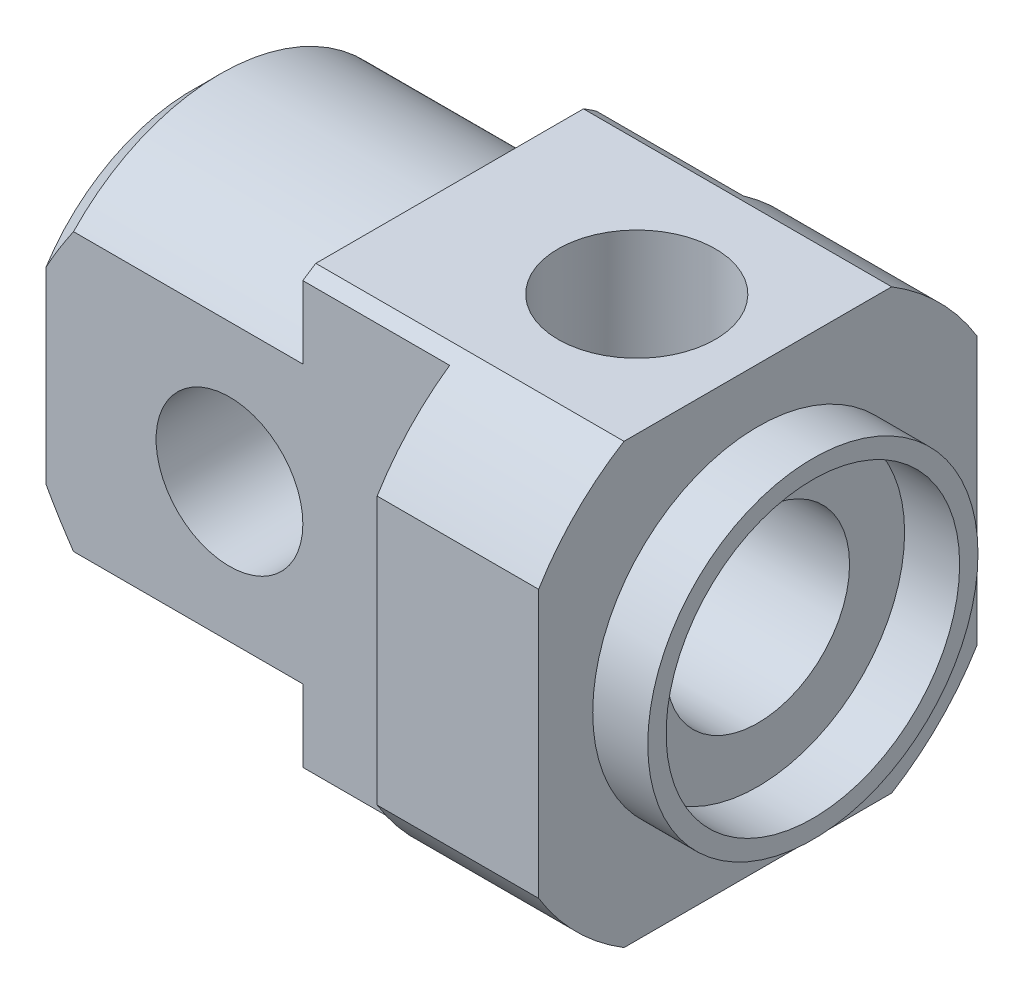
from build123d import *

# Parameters (mm, degrees)
CROQUIS2_OUTSIDE_W      = 40.034
CROQUIS2_OUTSIDE_H      = 40.034
CROQUIS2_OUTSIDE_W_2    = 23.9
CROQUIS2_OUTSIDE_H_2    = 23.9
CORTAR_EXTRUIR1_DEPTH   = 37.614751126
CROQUIS3_OUTSIDE_W      = 35.046
CROQUIS3_OUTSIDE_H      = 35.046
CROQUIS3_OUTSIDE_W_2    = 16
CROQUIS3_OUTSIDE_H_2    = 32
CORTAR_EXTRUIR2_DEPTH   = 22
CROQUIS4_R              = 9
CROQUIS4_R_2            = 8
SALIENTE_EXTRUIR1_DEPTH = 3
CROQUIS5_R              = 4
CORTAR_EXTRUIR3_DEPTH   = 42.027368914
CROQUIS8_R              = 5
CORTAR_EXTRUIR4_DEPTH   = 13
CROQUIS7_R              = 4.283
CORTAR_EXTRUIR5_DEPTH   = 13


with BuildPart() as part:
    # Croquis1 → Revolución1 (revolve)
    with BuildSketch(Plane(origin=(0, 0, 0), x_dir=(1, 0, 0), z_dir=(0, 1, 0)), mode=Mode.PRIVATE) as revoluci_n1_sk:
        Polygon((0, 0), (30.8, 0), (30.8, 14), (14, 14), (14, 11), (1.5, 11), (0, 9.5), align=None)
    revolve(revoluci_n1_sk.sketch.rotate(Axis((0, 0, 0), (1, 0, 0)), 180), axis=Axis((0, 0, 0), (1, 0, 0)))

    # Croquis2 outside → Cortar-Extruir1 (cut, through all)
    with BuildSketch(Plane(origin=(0, 0, 0), x_dir=(0, 0, -1), z_dir=(1, 0, 0))):
        Rectangle(CROQUIS2_OUTSIDE_W, CROQUIS2_OUTSIDE_H)
        Rectangle(CROQUIS2_OUTSIDE_W_2, CROQUIS2_OUTSIDE_H_2, mode=Mode.SUBTRACT)
    extrude(amount=CORTAR_EXTRUIR1_DEPTH, mode=Mode.SUBTRACT)

    # Croquis3 outside → Cortar-Extruir2 (cut)
    with BuildSketch(Plane(origin=(0, 0, 0), x_dir=(0, 0, -1), z_dir=(1, 0, 0))):
        Rectangle(CROQUIS3_OUTSIDE_W, CROQUIS3_OUTSIDE_H)
        Rectangle(CROQUIS3_OUTSIDE_W_2, CROQUIS3_OUTSIDE_H_2, mode=Mode.SUBTRACT)
    extrude(amount=CORTAR_EXTRUIR2_DEPTH, mode=Mode.SUBTRACT)

    # Croquis4 → Saliente-Extruir1 (add)
    with BuildSketch(Plane(origin=(30.8, 0, 0), x_dir=(0, 0, -1), z_dir=(1, 0, 0))):
        with Locations(Location((0, 0, 0), (0, 0, 180))):
            Circle(CROQUIS4_R)
        Circle(CROQUIS4_R_2, mode=Mode.SUBTRACT)
    extrude(amount=SALIENTE_EXTRUIR1_DEPTH)

    # Croquis5 → Cortar-Extruir3 (cut, through all)
    with BuildSketch(Plane.XY.offset(8)):
        with Locations((10, 0)):
            Circle(CROQUIS5_R)
    extrude(amount=-CORTAR_EXTRUIR3_DEPTH, mode=Mode.SUBTRACT)

    # Croquis8 → Cortar-Extruir4 (cut)
    with BuildSketch(Plane(origin=(30.8, 0, 0), x_dir=(0, 0, -1), z_dir=(1, 0, 0))):
        Circle(CROQUIS8_R)
    extrude(amount=-CORTAR_EXTRUIR4_DEPTH, mode=Mode.SUBTRACT)

    # Croquis7 → Cortar-Extruir5 (cut)
    with BuildSketch(Plane(origin=(0, 11.95, 0), x_dir=(1, 0, 0), z_dir=(0, 1, 0))):
        with Locations(Location((24.2, 0, 0), (0, 0, 270))):
            Circle(CROQUIS7_R)
    extrude(amount=-CORTAR_EXTRUIR5_DEPTH, mode=Mode.SUBTRACT)


solid = part.part
